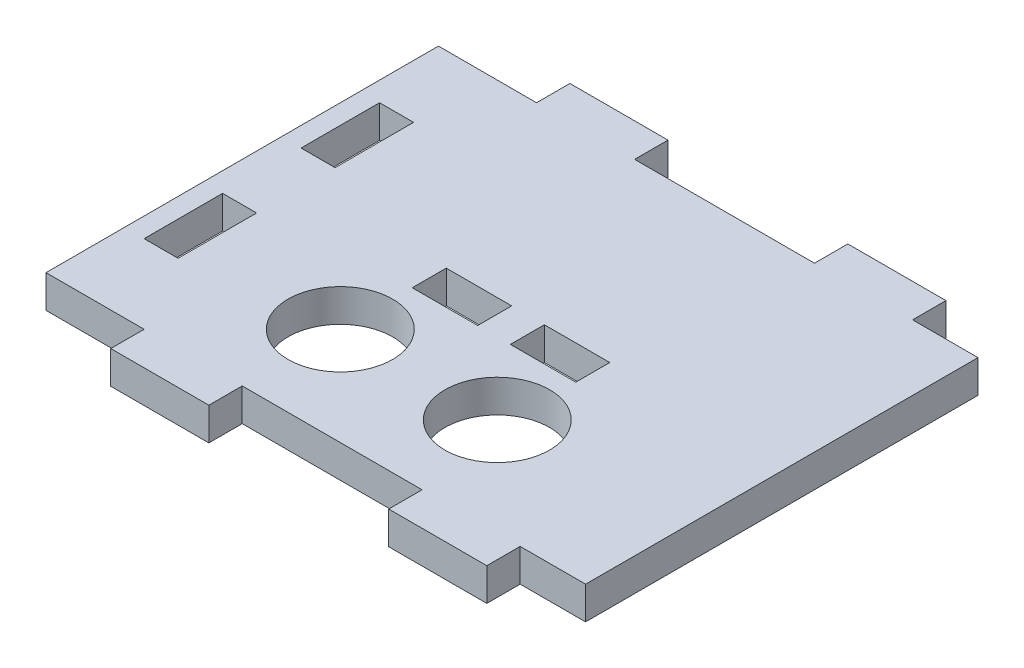
from build123d import *

# Parameters (mm, degrees)
SKETCH1_R           = 8
SKETCH1_W           = 10
SKETCH1_H           = 5.2
SKETCH1_W_2         = 5.2
SKETCH1_H_2         = 12
BOSS_EXTRUDE1_DEPTH = 5


with BuildPart() as part:
    # Sketch1 → Boss-Extrude1 (new body)
    with BuildSketch(Plane(origin=(0, 0, 0), x_dir=(1, 0, 0), z_dir=(0, 1, 0))):
        Polygon((25, 30), (25, -30), (15, -30), (15, -35.1), (0, -35.1), (0, -30), (-27.5, -30), (-27.5, -35.1), (-42.5, -35.1), (-42.5, -30), (-57.5, -30), (-57.5, 30), (-42.5, 30), (-42.5, 35.1), (-27.5, 35.1), (-27.5, 30), (0, 30), (0, 35.1), (15, 35.1), (15, 30), align=None)
        with Locations(Location((-27.5, -15, 0), (0, 0, 270))):
            Circle(SKETCH1_R, mode=Mode.SUBTRACT)
        with Locations(Location((-3.5, -15, 0), (0, 0, 270))):
            Circle(SKETCH1_R, mode=Mode.SUBTRACT)
        with Locations((-22.5, -1.4)):
            Rectangle(SKETCH1_W, SKETCH1_H, mode=Mode.SUBTRACT)
        with Locations((-7.5, -1.4)):
            Rectangle(SKETCH1_W, SKETCH1_H, mode=Mode.SUBTRACT)
        with Locations((-51.9, -12)):
            Rectangle(SKETCH1_W_2, SKETCH1_H_2, mode=Mode.SUBTRACT)
        with Locations((-51.9, 12)):
            Rectangle(SKETCH1_W_2, SKETCH1_H_2, mode=Mode.SUBTRACT)
    extrude(amount=BOSS_EXTRUDE1_DEPTH)


solid = part.part
